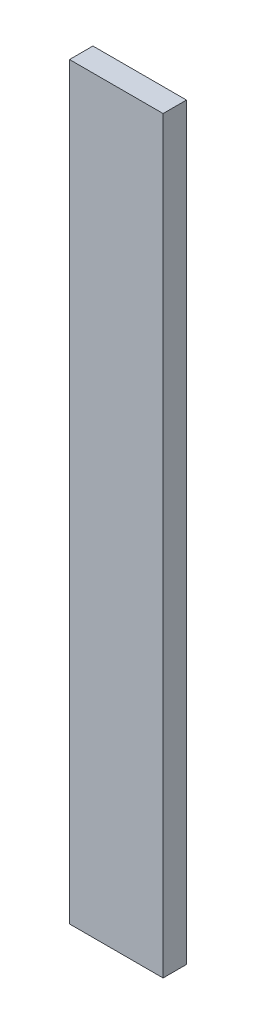
from build123d import *

# Parameters (mm, degrees)
ESQUISSE1_W        = 25.4
ESQUISSE1_H        = 203.2
BOSS_EXTRU_1_DEPTH = 6.35


with BuildPart() as part:
    # Esquisse1 → Boss.-Extru.1 (new body)
    with BuildSketch(Plane.XY):
        Rectangle(ESQUISSE1_W, ESQUISSE1_H)
    extrude(amount=BOSS_EXTRU_1_DEPTH)


solid = part.part
